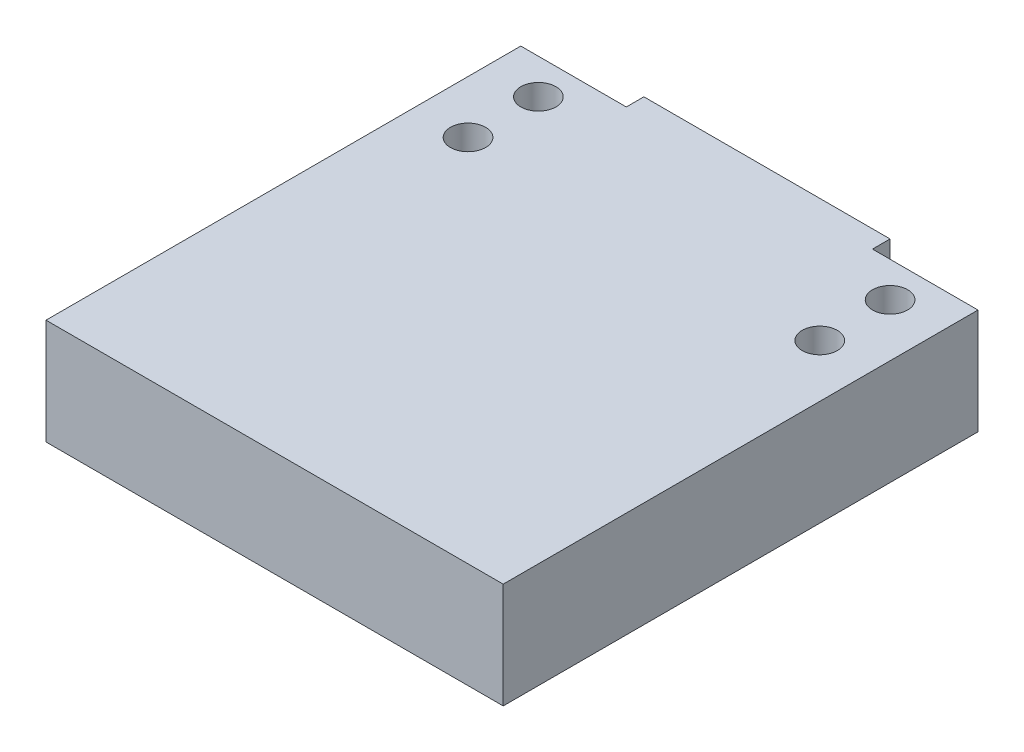
from build123d import *

# Parameters (mm, degrees)
BOSS_EXTRUDE1_DEPTH = 6
SKETCH2_R           = 1
CUT_EXTRUDE1_DEPTH  = 39.678159212


with BuildPart() as part:
    # Sketch1 → Boss-Extrude1 (new body)
    with BuildSketch(Plane(origin=(0, 0, 0), x_dir=(1, 0, 0), z_dir=(0, 1, 0))):
        Polygon((0, 27), (6, 27), (6, 28), (20, 28), (20, 27), (26, 27), (26, 0), (0, 0), align=None)
    extrude(amount=BOSS_EXTRUDE1_DEPTH)

    # Sketch2 → Cut-Extrude1 (cut, through all)
    with BuildSketch(Plane(origin=(0, 6, 0), x_dir=(1, 0, 0), z_dir=(0, 1, 0))):
        with Locations(Location((3, 25, 0), (0, 0, 270))):
            Circle(SKETCH2_R)
        with Locations(Location((23, 25, 0), (0, 0, 270))):
            Circle(SKETCH2_R)
        with Locations(Location((3, 21, 0), (0, 0, 270))):
            Circle(SKETCH2_R)
        with Locations(Location((23, 21, 0), (0, 0, 270))):
            Circle(SKETCH2_R)
    extrude(amount=-CUT_EXTRUDE1_DEPTH, mode=Mode.SUBTRACT)


solid = part.part
